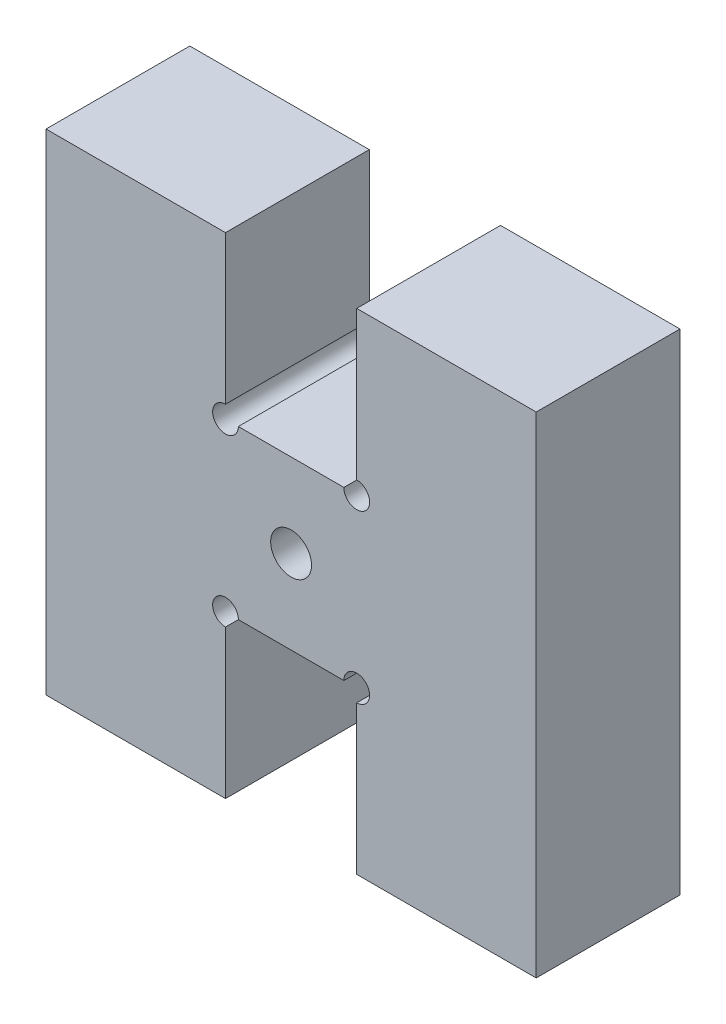
from build123d import *

# Parameters (mm, degrees)
SKETCH1_R               = 0.79375
BOSS_EXTRUDE1_DEPTH     = 5.588
CUT_EXTRUDE2_DEPTH      = 15.583449318
CUT_EXTRUDE2_DEPTH_BACK = 15.583449318
SKETCH2_R               = 0.5


with BuildPart() as part:
    # Sketch1 → Boss-Extrude1 (new body)
    with BuildSketch(Plane.XY):
        Polygon((-2.55, 3.25), (-2.55, 9.525), (-9.525, 9.525), (-9.525, -9.525), (-2.55, -9.525), (-2.55, -3.25), (2.55, -3.25), (2.55, -9.525), (9.525, -9.525), (9.525, 9.525), (2.55, 9.525), (2.55, 3.25), align=None)
        Circle(SKETCH1_R, mode=Mode.SUBTRACT)
    extrude(amount=BOSS_EXTRUDE1_DEPTH)

    # Sketch2 → Cut-Extrude2 (cut, two sides: drawn at the far end of the back side and taken through both)
    with BuildSketch(Plane.XY.offset(-CUT_EXTRUDE2_DEPTH_BACK)):
        with Locations((-2.55, 3.25)):
            Circle(SKETCH2_R)
        with Locations((2.55, 3.25)):
            Circle(SKETCH2_R)
        with Locations((2.55, -3.25)):
            Circle(SKETCH2_R)
        with Locations((-2.55, -3.25)):
            Circle(SKETCH2_R)
    extrude(amount=CUT_EXTRUDE2_DEPTH + CUT_EXTRUDE2_DEPTH_BACK, mode=Mode.SUBTRACT)


solid = part.part
